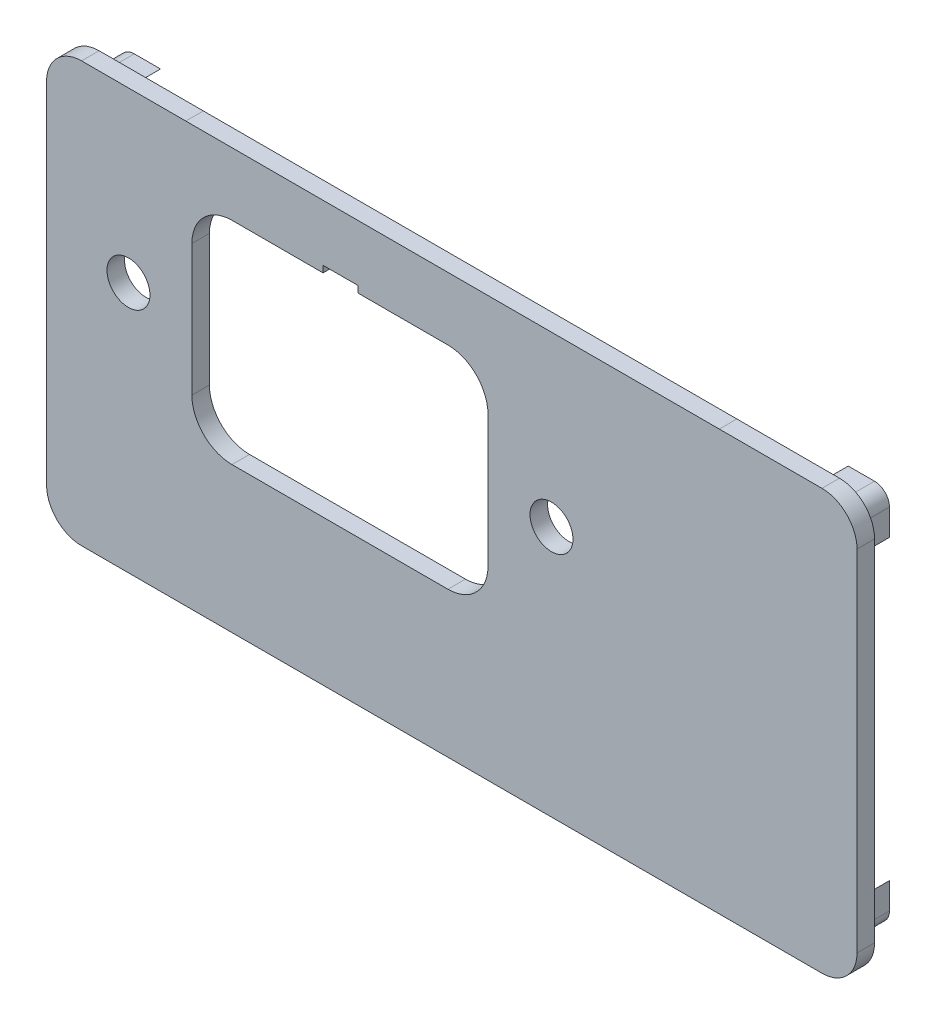
from build123d import *

# Parameters (mm, degrees)
SKETCH1_R           = 2.449
BOSS_EXTRUDE2_DEPTH = 2
BOSS_EXTRUDE3_DEPTH = 4


with BuildPart() as part:
    # Sketch1 → Boss-Extrude2 (new body)
    with BuildSketch(Plane.XY):
        with BuildLine():
            Line((9.168561928, 76.765332221), (-2.715276814, 76.765332221))
            ThreePointArc((-2.715276814, 76.765332221), (-5.543703939, 75.593759346), (-6.715276814, 72.765332221))
            Line((-6.715276814, 72.765332221), (-6.715276814, 32.85651365))
            ThreePointArc((-6.715276814, 32.85651365), (-5.543703939, 30.028086525), (-2.715276814, 28.85651365))
            Line((-2.715276814, 28.85651365), (81.739723186, 28.85651365))
            ThreePointArc((81.739723186, 28.85651365), (84.56815031, 30.028086525), (85.739723186, 32.85651365))
            Line((85.739723186, 32.85651365), (85.739723186, 72.765508714))
            ThreePointArc((85.739723186, 72.765508714), (84.56815031, 75.593935839), (81.739723186, 76.765508714))
            Line((81.739723186, 76.765508714), (70.033136805, 76.765508714))
            Line((70.033136805, 76.765508714), (9.168561928, 76.765332221))
        make_face()
        with Locations((50.884863874, 57.525313638)):
            Circle(SKETCH1_R, mode=Mode.SUBTRACT)
        with Locations((2.624863871, 57.525313638)):
            Circle(SKETCH1_R, mode=Mode.SUBTRACT)
        with BuildLine():
            Line((36.022761907, 69.590313638), (39.073863873, 69.590313638))
            ThreePointArc((39.073863873, 69.590313638), (42.306756076, 68.251205842), (43.645863873, 65.018313638))
            Line((43.645863873, 65.018313638), (43.645863873, 50.032313637))
            ThreePointArc((43.645863873, 50.032313637), (42.306756076, 46.799421434), (39.073863873, 45.460313637))
            Line((39.073863873, 45.460313637), (36.022761907, 45.460313637))
            Line((36.022761907, 45.460313637), (17.486965838, 45.460313637))
            Line((17.486965838, 45.460313637), (14.435863872, 45.460313637))
            ThreePointArc((14.435863872, 45.460313637), (11.202971669, 46.799421434), (9.863863872, 50.032313637))
            Line((9.863863872, 50.032313637), (9.863863872, 65.018313638))
            ThreePointArc((9.863863872, 65.018313638), (11.202971669, 68.251205842), (14.435863872, 69.590313638))
            Line((14.435863872, 69.590313638), (17.486965838, 69.590313638))
            Line((17.486965838, 69.590313638), (24.826000411, 69.590313638))
            Line((24.826000411, 69.590313638), (24.826000411, 70.340313638))
            Line((24.826000411, 70.340313638), (28.826000411, 70.340313638))
            Line((28.826000411, 70.340313638), (28.826000411, 69.590313638))
            Line((28.826000411, 69.590313638), (36.022761907, 69.590313638))
        make_face(mode=Mode.SUBTRACT)
    extrude(amount=BOSS_EXTRUDE2_DEPTH)

    # Sketch2 → Boss-Extrude3 (add)
    with BuildSketch(Plane(origin=(0, 0, 0), x_dir=(-1, 0, 0), z_dir=(0, 0, -1))):
        with BuildLine():
            Line((-83.439723186, 32.85651365), (-83.439723186, 35.85651365))
            Line((-83.439723186, 35.85651365), (-78.739723186, 31.15651365))
            Line((-78.739723186, 31.15651365), (-81.739723186, 31.15651365))
            ThreePointArc((-81.739723186, 31.15651365), (-82.941804714, 31.654432122), (-83.439723186, 32.85651365))
        make_face()
        with BuildLine():
            Line((-81.739723186, 74.465508714), (-78.739723186, 74.465508714))
            Line((-78.739723186, 74.465508714), (-83.439723186, 69.765508714))
            Line((-83.439723186, 69.765508714), (-83.439723186, 72.765508714))
            ThreePointArc((-83.439723186, 72.765508714), (-82.941804714, 73.967590242), (-81.739723186, 74.465508714))
        make_face()
        with BuildLine():
            Line((2.715276814, 31.15651365), (-0.284723186, 31.15651365))
            Line((-0.284723186, 31.15651365), (4.415276814, 35.85651365))
            Line((4.415276814, 35.85651365), (4.415276814, 32.85651365))
            ThreePointArc((4.415276814, 32.85651365), (3.917358342, 31.654432122), (2.715276814, 31.15651365))
        make_face()
        with BuildLine():
            Line((4.415276814, 72.765332221), (4.415276814, 69.765332221))
            Line((4.415276814, 69.765332221), (-0.284723186, 74.465332221))
            Line((-0.284723186, 74.465332221), (2.715276814, 74.465332221))
            ThreePointArc((2.715276814, 74.465332221), (3.917358342, 73.967413749), (4.415276814, 72.765332221))
        make_face()
    extrude(amount=BOSS_EXTRUDE3_DEPTH)


solid = part.part
